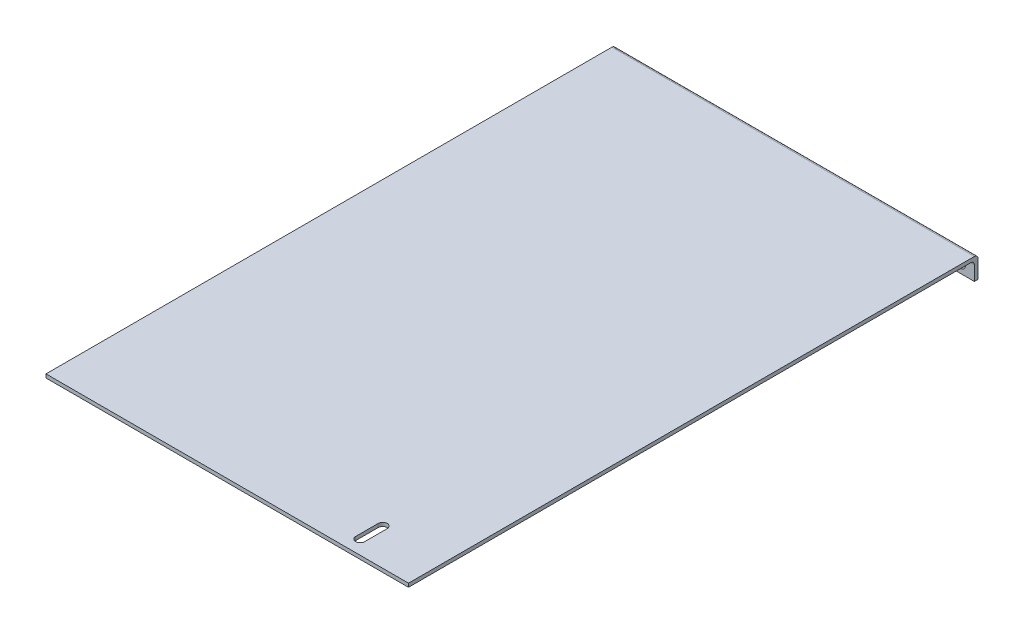
from build123d import *

# Parameters (mm, degrees)
SKETCH1_W           = 315
SKETCH1_H           = 2
BOSS_EXTRUDE1_DEPTH = 200.5
SKETCH16_W          = 200.5
SKETCH16_H          = 2
BOSS_EXTRUDE2_DEPTH = 10
FILLET1_R           = 2
FILLET2_R           = 2
SKETCH17_R          = 2.5
CUT_EXTRUDE1_DEPTH  = 2
CUT_EXTRUDE2_DEPTH  = 2


with BuildPart() as part:
    # Sketch1 → Boss-Extrude1 (new body)
    with BuildSketch(Plane(origin=(0, 0, 0), x_dir=(0, 0, -1), z_dir=(1, 0, 0))):
        with Locations((157.5, 1)):
            Rectangle(SKETCH1_W, SKETCH1_H)
    extrude(amount=BOSS_EXTRUDE1_DEPTH)

    # Sketch16 → Boss-Extrude2 (add)
    with BuildSketch(Plane.XZ):
        with Locations((100.25, -314)):
            Rectangle(SKETCH16_W, SKETCH16_H)
    extrude(amount=BOSS_EXTRUDE2_DEPTH)

    # Fillet1
    fillet1_edges = [part.edges().sort_by_distance(p)[0] for p in [
        (100.25, 2, -315),
    ]]
    fillet(fillet1_edges, radius=FILLET1_R)

    # Fillet2
    fillet2_edges = [part.edges().sort_by_distance(p)[0] for p in [
        (100.25, 0, -313),
    ]]
    fillet(fillet2_edges, radius=FILLET2_R)

    # Sketch17 → Cut-Extrude1 (cut)
    with BuildSketch(Plane(origin=(0, 0, -315), x_dir=(-1, 0, 0), z_dir=(0, 0, -1))):
        with Locations((-193, -5)):
            Circle(SKETCH17_R)
        with Locations((-7.5, -5)):
            Circle(SKETCH17_R)
    extrude(amount=-CUT_EXTRUDE1_DEPTH, mode=Mode.SUBTRACT)

    # Sketch19 → Cut-Extrude2 (cut)
    with BuildSketch(Plane(origin=(0, 2, 0), x_dir=(1, 0, 0), z_dir=(0, 1, 0))):
        with BuildLine():
            Line((163.5, 20.25), (163.5, 7.75))
            ThreePointArc((163.5, 7.75), (166, 5.25), (168.5, 7.75))
            Line((168.5, 7.75), (168.5, 20.25))
            ThreePointArc((168.5, 20.25), (166, 22.75), (163.5, 20.25))
        make_face()
    extrude(amount=-CUT_EXTRUDE2_DEPTH, mode=Mode.SUBTRACT)


solid = part.part
